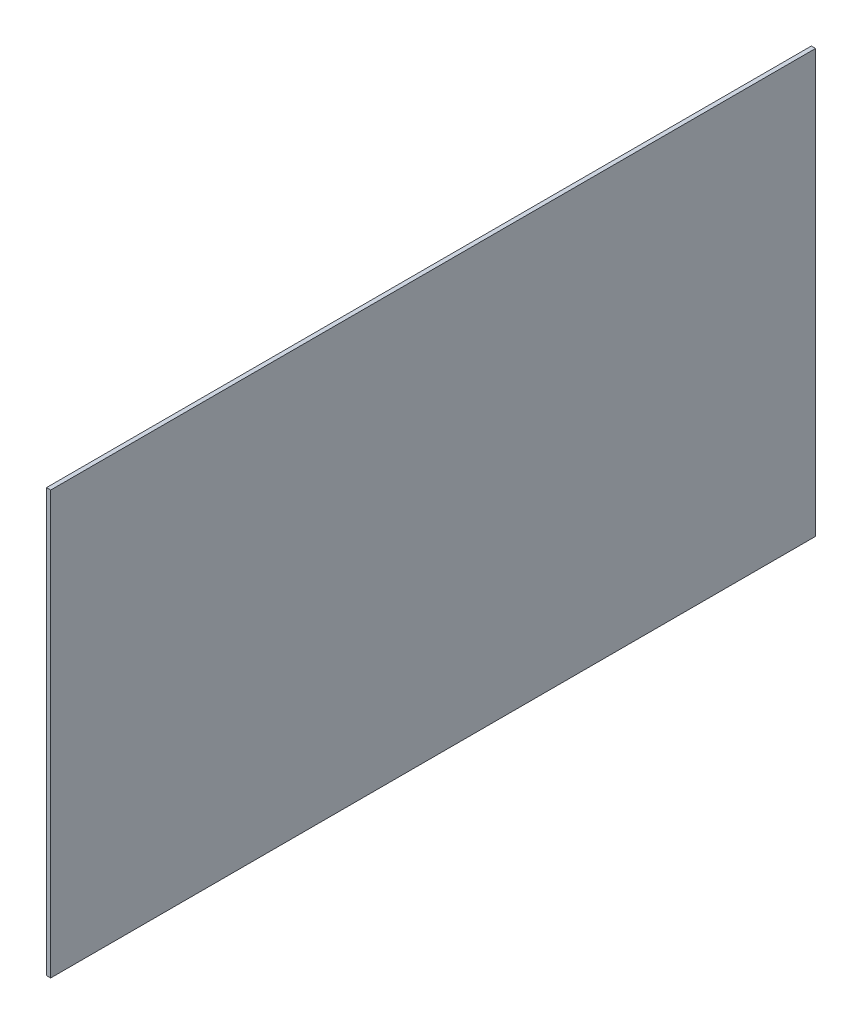
from build123d import *

# Parameters (mm, degrees)
SKETCH1_W           = 3
SKETCH1_H           = 543
BOSS_EXTRUDE1_DEPTH = 300


with BuildPart() as part:
    # Sketch1 → Boss-Extrude1 (new body)
    with BuildSketch(Plane(origin=(0, 0, 0), x_dir=(1, 0, 0), z_dir=(0, 1, 0))):
        Rectangle(SKETCH1_W, SKETCH1_H)
    extrude(amount=BOSS_EXTRUDE1_DEPTH)


solid = part.part
